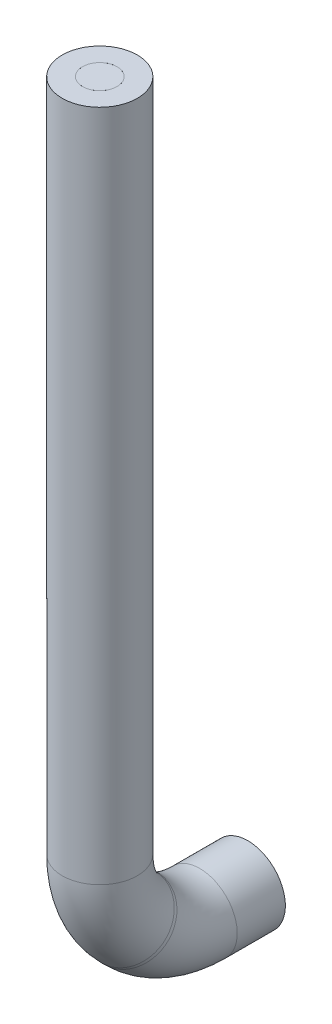
from build123d import *

# Parameters (mm, degrees)
SKETCH_2_R   = 0.39
SKETCH_3_R   = 0.85
SKETCH_3_R_2 = 0.39


with BuildPart() as part:
    # По траектории1: sweep along a path in Эскиз1
    with BuildLine(Plane(origin=(0, 0, 0), x_dir=(0, 0, -1), z_dir=(1, 0, 0))) as sweep_1_path:
        Line((0, 17.49999984), (0, 2.26126984))
        ThreePointArc((0, 2.26126984), (0.167465028, 1.419366289), (0.644365081, 0.705634921))
        Line((0.644365081, 0.705634921), (0.705634921, 0.644365081))
        ThreePointArc((0.705634921, 0.644365081), (1.419366289, 0.167465028), (2.26126984, 0))
        Line((2.26126984, 0), (3.35, 0))
    # Эскиз2 → По траектории1 (sweep)
    with BuildSketch(Plane.XY.offset(-3.35)):
        Circle(SKETCH_2_R)
    sweep(path=sweep_1_path.line)


with BuildPart() as body_2:
    # По траектории2: sweep along a path in Эскиз1<2>
    with BuildLine(Plane(origin=(0, 0, 0), x_dir=(0, 0, -1), z_dir=(1, 0, 0))) as sweep_2_path:
        Line((0, 17.49999984), (0, 2.26126984))
        ThreePointArc((0, 2.26126984), (0.167465028, 1.419366289), (0.644365081, 0.705634921))
        Line((0.644365081, 0.705634921), (0.705634921, 0.644365081))
        ThreePointArc((0.705634921, 0.644365081), (1.419366289, 0.167465028), (2.26126984, 0))
        Line((2.26126984, 0), (3.35, 0))
    # Эскиз3 → По траектории2 (sweep)
    with BuildSketch(Plane(origin=(0, 0, -3.35), x_dir=(-1, 0, 0), z_dir=(0, 0, -1))):
        Circle(SKETCH_3_R)
        Circle(SKETCH_3_R_2, mode=Mode.SUBTRACT)
    sweep(path=sweep_2_path.line)


solid = Compound([part.part, body_2.part])
